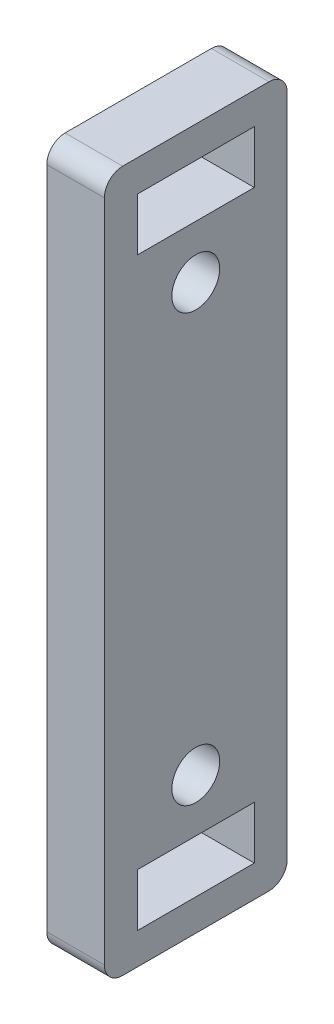
from build123d import *

# Parameters (mm, degrees)
SKETCH1_W           = 9.525
SKETCH1_H           = 36.5125
BOSS_EXTRUDE1_DEPTH = 1.5
FILLET1_R           = 0.9525
SKETCH2_R           = 1.246
SKETCH2_W           = 6.096
SKETCH2_H           = 2.746
CUT_EXTRUDE1_DEPTH  = 20.104242207


with BuildPart() as part:
    # Sketch1 → Boss-Extrude1 (new, symmetric)
    with BuildSketch(Plane(origin=(0, 0, 0), x_dir=(0, 0, -1), z_dir=(1, 0, 0))):
        Rectangle(SKETCH1_W, SKETCH1_H)
    extrude(amount=BOSS_EXTRUDE1_DEPTH, both=True)

    # Fillet1
    fillet1_edges = [part.edges().sort_by_distance(p)[0] for p in [
        (0, 18.25625, 4.7625),
        (0, 18.25625, -4.7625),
        (0, -18.25625, -4.7625),
        (0, -18.25625, 4.7625),
    ]]
    fillet(fillet1_edges, radius=FILLET1_R)

    # Sketch2 → Cut-Extrude1 (cut, through all)
    with BuildSketch(Plane(origin=(1.5, 0, 0), x_dir=(0, 0, -1), z_dir=(1, 0, 0))):
        with Locations((0, 11.1125)):
            Circle(SKETCH2_R)
        with Locations((0, 15.24)):
            Rectangle(SKETCH2_W, SKETCH2_H)
    cut_extrude1 = extrude(amount=-CUT_EXTRUDE1_DEPTH, mode=Mode.SUBTRACT)

    # Mirror1: Cut-Extrude1 across plane
    add(cut_extrude1.mirror(Plane.ZX), mode=Mode.SUBTRACT)


solid = part.part
